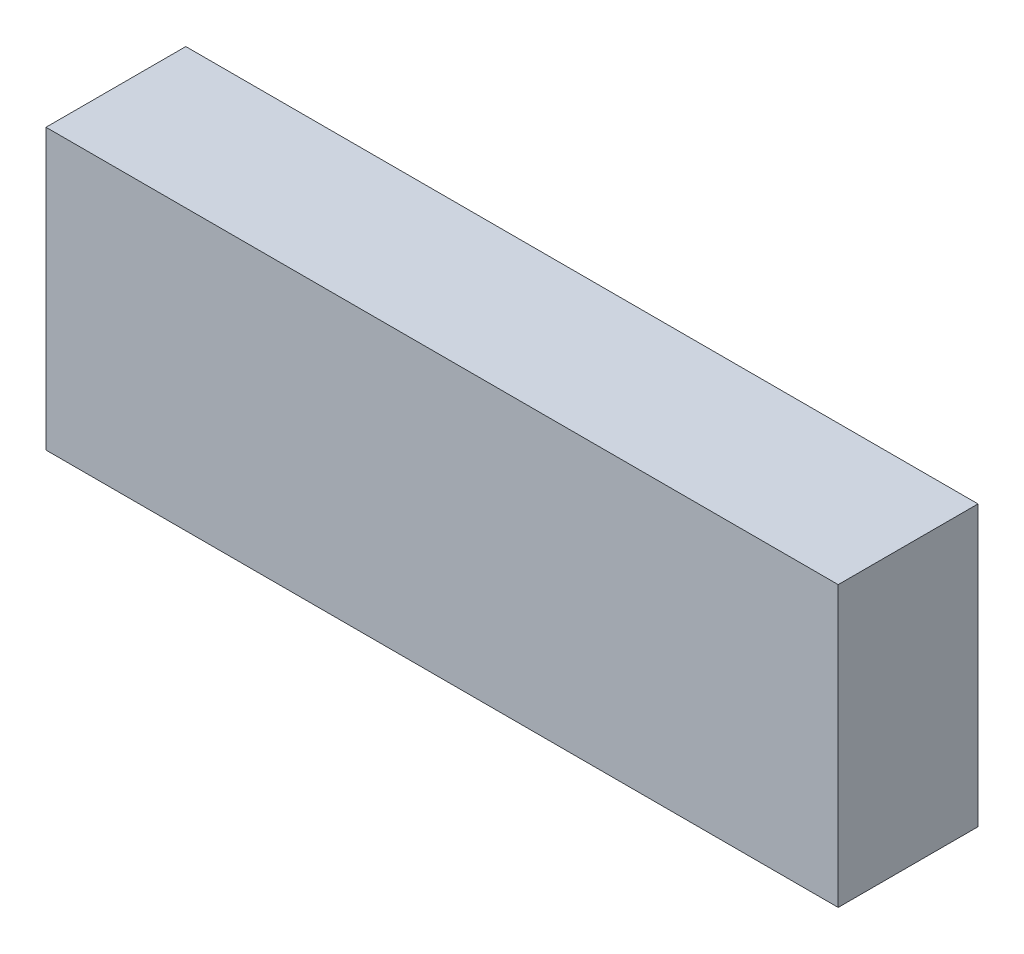
from build123d import *

# Parameters (mm, degrees)
SKETCH1_W           = 107.95
SKETCH1_H           = 38.1
BOSS_EXTRUDE2_DEPTH = 19.05


with BuildPart() as part:
    # Sketch1 → Boss-Extrude2 (new body)
    with BuildSketch(Plane.XY):
        with Locations((-0.977045526, 6.165281251)):
            Rectangle(SKETCH1_W, SKETCH1_H)
    extrude(amount=BOSS_EXTRUDE2_DEPTH)


solid = part.part
